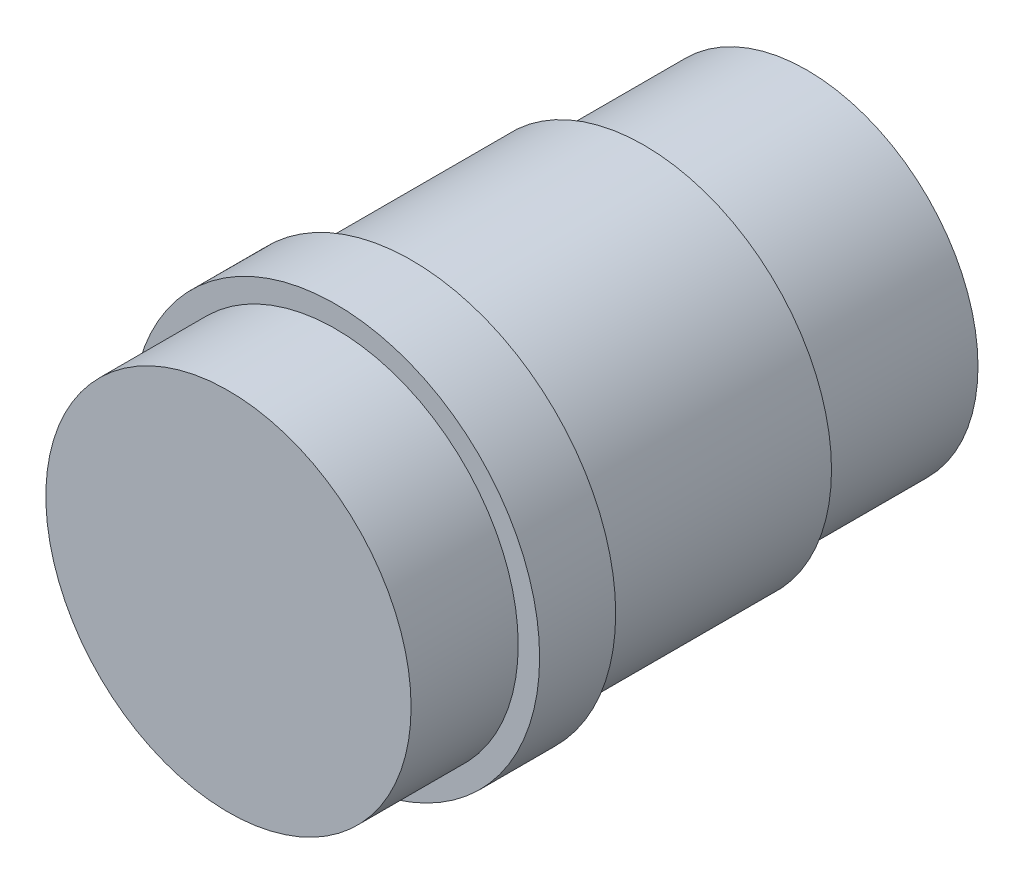
from build123d import *


with BuildPart() as part:
    # Croquis1 → Revolución1 (revolve)
    with BuildSketch(Plane(origin=(0, 0, 0), x_dir=(0, 0, -1), z_dir=(1, 0, 0)), mode=Mode.PRIVATE) as revoluci_n1_sk:
        Polygon((0, 0), (27, 0), (27, 7.9883), (19.4, 7.9883), (19.4, 8.75), (8.55, 8.75), (8.55, 9.525), (5, 9.525), (5, 8.525), (0, 8.525), align=None)
    revolve(revoluci_n1_sk.sketch.rotate(Axis((0, 0, 0), (0, 0, -1)), 90), axis=Axis((0, 0, 0), (0, 0, -1)))


solid = part.part
